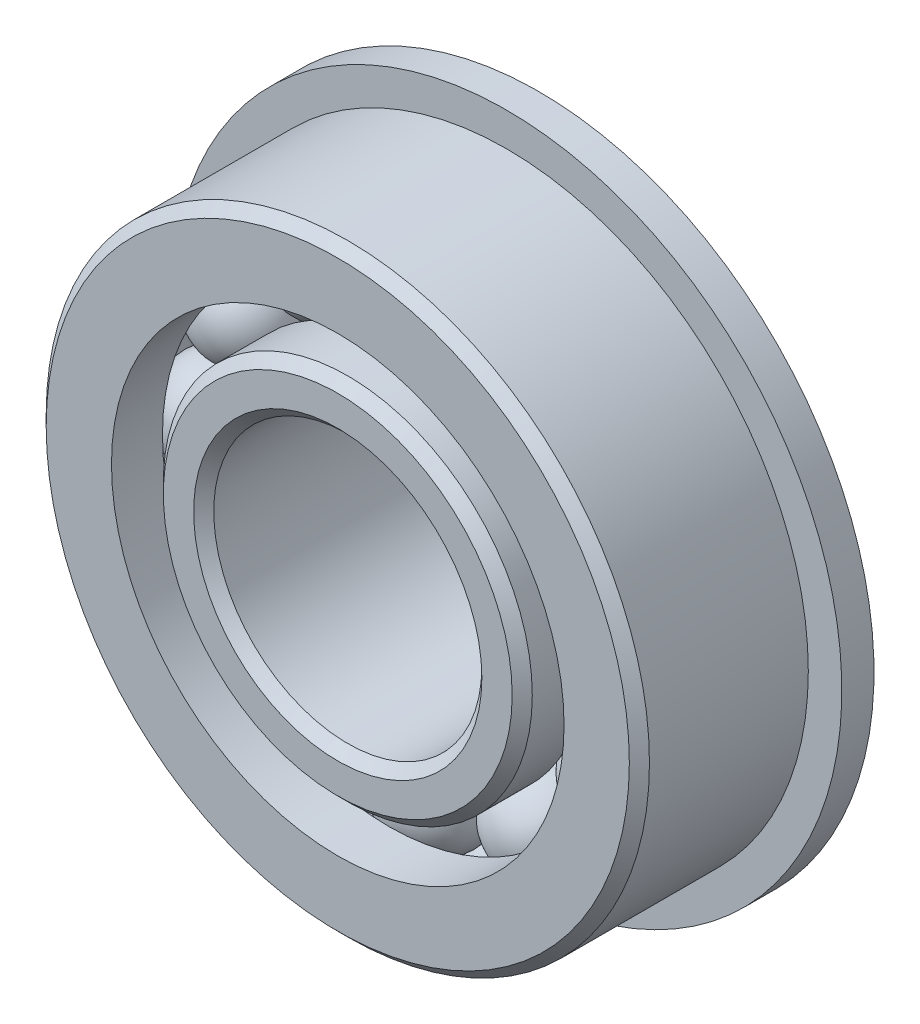
from build123d import *

# Parameters (mm, degrees)
SKETCH6_W         = 1.524
SKETCH6_H         = 5.1562
CIRPATTERN1_COUNT = 12


with BuildPart() as part:
    # Sketch1 → Revolve1 (revolve)
    with BuildSketch(Plane(origin=(0, 0, 0), x_dir=(0, 0, -1), z_dir=(1, 0, 0)), mode=Mode.PRIVATE) as revolve1_sk:
        with BuildLine():
            Line((4.28625, 14.2875), (-4.28625, 14.2875))
            Line((-4.28625, 14.2875), (-4.7625, 13.81125))
            Line((-4.7625, 13.81125), (-4.7625, 10.7188))
            Line((-4.7625, 10.7188), (-2.347405282, 10.7188))
            ThreePointArc((-2.347405282, 10.7188), (0, 12.7), (2.347405282, 10.7188))
            Line((2.347405282, 10.7188), (4.7625, 10.7188))
            Line((4.7625, 10.7188), (4.7625, 13.81125))
            Line((4.7625, 13.81125), (4.28625, 14.2875))
        make_face()
    revolve(revolve1_sk.sketch.rotate(Axis((0, 0, 4.7625), (0, 0, -1)), 90), axis=Axis((0, 0, 4.7625), (0, 0, -1)))

    # Sketch6 → Revolve6 (revolve)
    with BuildSketch(Plane(origin=(0, 0, 0), x_dir=(0, 0, -1), z_dir=(1, 0, 0)), mode=Mode.PRIVATE) as revolve6_sk:
        with Locations((4.0005, 13.2969)):
            Rectangle(SKETCH6_W, SKETCH6_H)
    revolve(revolve6_sk.sketch.rotate(Axis((0, 0, -4.7625), (0, 0, 1)), 270), axis=Axis((0, 0, -4.7625), (0, 0, 1)))


with BuildPart() as body_2:
    # Sketch3 → Revolve3 (revolve)
    with BuildSketch(Plane(origin=(0, 0, 0), x_dir=(0, 0, -1), z_dir=(1, 0, 0)), mode=Mode.PRIVATE) as revolve3_sk:
        with BuildLine():
            Line((-4.7625, 6.82625), (-4.7625, 8.26135))
            Line((-4.7625, 8.26135), (-4.28625, 8.7376))
            Line((-4.28625, 8.7376), (-1.780538188, 8.7376))
            ThreePointArc((-1.780538188, 8.7376), (0, 7.9375), (1.780538188, 8.7376))
            Line((1.780538188, 8.7376), (5.88645, 8.7376))
            Line((5.88645, 8.7376), (6.3627, 8.26135))
            Line((6.3627, 8.26135), (6.3627, 6.82625))
            Line((6.3627, 6.82625), (5.88645, 6.35))
            Line((5.88645, 6.35), (-4.28625, 6.35))
            Line((-4.28625, 6.35), (-4.7625, 6.82625))
        make_face()
    revolve(revolve3_sk.sketch.rotate(Axis((0, 0, 4.7625), (0, 0, -1)), 90), axis=Axis((0, 0, 4.7625), (0, 0, -1)))


with BuildPart() as body_3:
    # Sketch4 → Revolve4 (revolve)
    with BuildSketch(Plane(origin=(0, 0, 0), x_dir=(0, 0, -1), z_dir=(1, 0, 0))):
        with BuildLine():
            Line((-2.38125, 10.31875), (2.38125, 10.31875))
            ThreePointArc((2.38125, 10.31875), (0, 12.7), (-2.38125, 10.31875))
        make_face()
    revolve(axis=Axis((0, 10.31875, 2.38125), (0, 0, -1)))


with BuildPart() as cirpattern1_1:
    # CirPattern1: pattern copy
    add(body_3.part.rotate(Axis((0, 0, 0), (0, 0, 1)), 1 * 360 / CIRPATTERN1_COUNT))


with BuildPart() as cirpattern1_2:
    # CirPattern1: pattern copy
    add(body_3.part.rotate(Axis((0, 0, 0), (0, 0, 1)), 2 * 360 / CIRPATTERN1_COUNT))


with BuildPart() as cirpattern1_3:
    # CirPattern1: pattern copy
    add(body_3.part.rotate(Axis((0, 0, 0), (0, 0, 1)), 3 * 360 / CIRPATTERN1_COUNT))


with BuildPart() as cirpattern1_4:
    # CirPattern1: pattern copy
    add(body_3.part.rotate(Axis((0, 0, 0), (0, 0, 1)), 4 * 360 / CIRPATTERN1_COUNT))


with BuildPart() as cirpattern1_5:
    # CirPattern1: pattern copy
    add(body_3.part.rotate(Axis((0, 0, 0), (0, 0, 1)), 5 * 360 / CIRPATTERN1_COUNT))


with BuildPart() as cirpattern1_6:
    # CirPattern1: pattern copy
    add(body_3.part.rotate(Axis((0, 0, 0), (0, 0, 1)), 6 * 360 / CIRPATTERN1_COUNT))


with BuildPart() as cirpattern1_7:
    # CirPattern1: pattern copy
    add(body_3.part.rotate(Axis((0, 0, 0), (0, 0, 1)), 7 * 360 / CIRPATTERN1_COUNT))


with BuildPart() as cirpattern1_8:
    # CirPattern1: pattern copy
    add(body_3.part.rotate(Axis((0, 0, 0), (0, 0, 1)), 8 * 360 / CIRPATTERN1_COUNT))


with BuildPart() as cirpattern1_9:
    # CirPattern1: pattern copy
    add(body_3.part.rotate(Axis((0, 0, 0), (0, 0, 1)), 9 * 360 / CIRPATTERN1_COUNT))


with BuildPart() as cirpattern1_10:
    # CirPattern1: pattern copy
    add(body_3.part.rotate(Axis((0, 0, 0), (0, 0, 1)), 10 * 360 / CIRPATTERN1_COUNT))


with BuildPart() as cirpattern1_11:
    # CirPattern1: pattern copy
    add(body_3.part.rotate(Axis((0, 0, 0), (0, 0, 1)), 11 * 360 / CIRPATTERN1_COUNT))


solid = Compound([part.part, body_2.part, body_3.part, cirpattern1_1.part, cirpattern1_2.part, cirpattern1_3.part, cirpattern1_4.part, cirpattern1_5.part, cirpattern1_6.part, cirpattern1_7.part, cirpattern1_8.part, cirpattern1_9.part, cirpattern1_10.part, cirpattern1_11.part])
